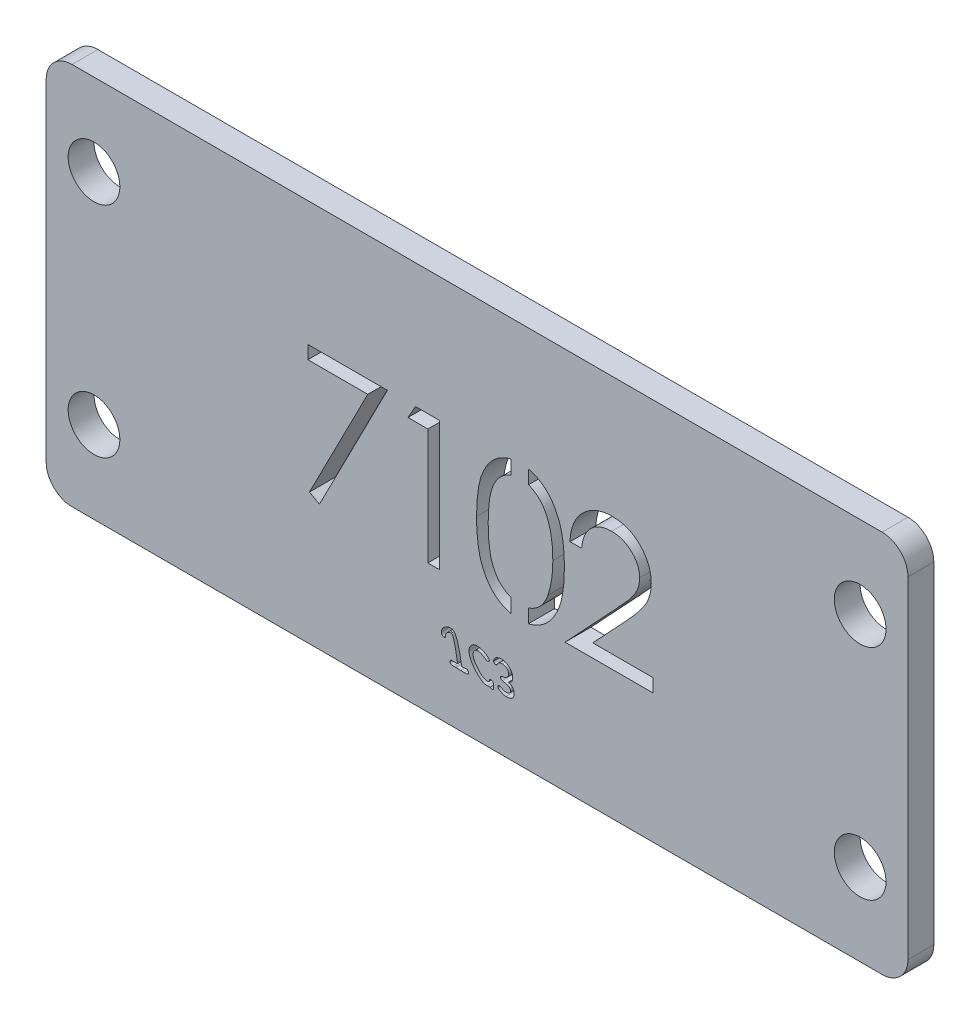
from build123d import *

# Parameters (mm, degrees)
SKETCH1_W               = 100
SKETCH1_H               = 44.45
SKETCH1_R               = 3
BOSS_EXTRUDE1_DEPTH     = 1.5
FILLET1_R               = 3
CUT_EXTRUDE1_DEPTH      = 55.799184529
CUT_EXTRUDE1_DEPTH_BACK = 55.799184529
BOSS_EXTRUDE2_DEPTH     = 3
CUT_EXTRUDE2_DEPTH      = 55.799184666
CUT_EXTRUDE2_DEPTH_BACK = 55.799184666


with BuildPart() as part:
    # Sketch1 → Boss-Extrude1 (new, symmetric)
    with BuildSketch(Plane.XY):
        Rectangle(SKETCH1_W, SKETCH1_H)
        with Locations((-44.45, 12.7)):
            Circle(SKETCH1_R, mode=Mode.SUBTRACT)
        with Locations((-44.45, -12.7)):
            Circle(SKETCH1_R, mode=Mode.SUBTRACT)
        with Locations((44.45, 12.7)):
            Circle(SKETCH1_R, mode=Mode.SUBTRACT)
        with Locations((44.45, -12.7)):
            Circle(SKETCH1_R, mode=Mode.SUBTRACT)
    extrude(amount=BOSS_EXTRUDE1_DEPTH, both=True)

    # Fillet1
    fillet1_edges = [part.edges().sort_by_distance(p)[0] for p in [
        (50, -22.225, 0),
        (-50, -22.225, 0),
        (-50, 22.225, 0),
        (50, 22.225, 0),
    ]]
    fillet(fillet1_edges, radius=FILLET1_R)

    # Sketch2 → Cut-Extrude1 (cut, two sides: drawn at the far end of the back side and taken through both)
    # profile 1 of 4: a face of its own
    with BuildSketch(Plane.XY.offset(1.5).offset(-CUT_EXTRUDE1_DEPTH_BACK)):
        Polygon((-19.634615385, 7.775), (-10.403846154, 7.775), (-18.288461538, -7.609615385), (-19.451322115, -6.969591346), (-12.681490385, 6.236538462), (-19.634615385, 6.236538462), align=None)
    # profile 2 of 4: a face of its own
    with BuildSketch(Plane.XY.offset(1.5).offset(-CUT_EXTRUDE1_DEPTH_BACK)):
        Polygon((-7.138822115, 7.775), (-4.365384615, 7.775), (-4.365384615, -7.225), (-5.711538462, -7.225), (-5.711538462, 6.236538462), (-8.019230769, 6.236538462), align=None)
    # profile 3 of 4: a face of its own
    with BuildSketch(Plane.XY.offset(1.5).offset(-CUT_EXTRUDE1_DEPTH_BACK)):
        with BuildLine():
            add(Edge.make_bspline(
                [(-0.057692308, 0.268990385), (-0.056286516, 0.509407761), (-0.053555744, 0.976421979), (-0.023176797, 1.656927588), (0.027288956, 2.295328826), (0.096449125, 2.891656252), (0.180611897, 3.446063814), (0.292963983, 3.957069916), (0.420733137, 4.427039659), (0.568815047, 4.857505581), (0.735905572, 5.254267165), (0.917766689, 5.624660885), (1.121615808, 5.96812631), (1.335802578, 6.290145411), (1.56899717, 6.58544696), (1.814563415, 6.858201228), (2.082085742, 7.102104445), (2.362470063, 7.324302883), (2.658254911, 7.519086333), (2.961009194, 7.690655213), (3.272816791, 7.837226073), (3.594529003, 7.952470798), (3.923254251, 8.047660141), (4.26014168, 8.112755631), (4.605747525, 8.153713811), (4.839025103, 8.157629529), (4.957331731, 8.159615385)],
                knots=[0, 0, 0, 0, 1.646270934, 3.197905019, 4.663502075, 6.030701355, 7.308322542, 8.50163776, 9.611534131, 10.641858119, 11.616356847, 12.558055219, 13.465016945, 14.349605745, 15.204443733, 16.039544428, 16.859896111, 17.680448484, 18.487036065, 19.28249412, 20.06191084, 20.843045899, 21.620316918, 22.403196591, 23.190181807, 24, 24, 24, 24], degree=3))
            add(Edge.make_bspline(
                [(4.957331731, 8.159615385), (5.076626639, 8.157524748), (5.313866677, 8.15336713), (5.664611142, 8.113407376), (6.007252635, 8.047102563), (6.340330372, 7.953155529), (6.666580314, 7.836602629), (6.983450633, 7.690514984), (7.292909554, 7.520462696), (7.590039358, 7.320646079), (7.878101995, 7.097864895), (8.150021836, 6.846024886), (8.405823633, 6.567668946), (8.648717799, 6.265775244), (8.871813216, 5.934553452), (9.084270782, 5.57976441), (9.27443665, 5.19520356), (9.457585258, 4.78728727), (9.615672344, 4.344728732), (9.758241967, 3.870022615), (9.873437547, 3.357561815), (9.969391571, 2.810035049), (10.043726839, 2.225431549), (10.097866734, 1.605004483), (10.12646567, 0.948345666), (10.131851532, 0.499383455), (10.134615385, 0.268990385)],
                knots=[0, 0, 0, 0, 0.810914788, 1.612654377, 2.396697861, 3.181598691, 3.963628158, 4.749916497, 5.551656086, 6.361998678, 7.18212741, 8.025565596, 8.878627764, 9.750805457, 10.657531673, 11.591944965, 12.560506719, 13.57287815, 14.630710178, 15.753379473, 16.941251878, 18.199788006, 19.531962791, 20.947069417, 22.433333509, 24, 24, 24, 24], degree=3))
            add(Edge.make_bspline(
                [(10.134615385, 0.268990385), (10.131822879, 0.039602208), (10.126381797, -0.4073513), (10.098187339, -1.06105548), (10.042650349, -1.678189951), (9.97317897, -2.260234791), (9.876960557, -2.804767443), (9.758652702, -3.313672222), (9.627294176, -3.789146815), (9.465145058, -4.227296007), (9.287670585, -4.634231962), (9.094576887, -5.014234027), (8.887706204, -5.370660995), (8.662325868, -5.700659911), (8.422096955, -6.006568441), (8.16187786, -6.282986824), (7.889003924, -6.536575418), (7.60009357, -6.76222525), (7.298329779, -6.959731556), (6.989933735, -7.136362343), (6.669433521, -7.278788179), (6.344092295, -7.401081212), (6.00925644, -7.49451172), (5.665343337, -7.559113958), (5.314102326, -7.60442188), (5.076667047, -7.607878222), (4.957331731, -7.609615385)],
                knots=[0, 0, 0, 0, 1.561518951, 3.042555995, 4.452378317, 5.7783523, 7.031515105, 8.214008947, 9.334062868, 10.386615937, 11.391082383, 12.354592575, 13.286541444, 14.194233754, 15.072674879, 15.931287219, 16.775624067, 17.606195743, 18.42308326, 19.229000347, 20.022332153, 20.807536673, 21.593273796, 22.3848459, 23.188221202, 24, 24, 24, 24], degree=3))
            add(Edge.make_bspline(
                [(4.957331731, -7.609615385), (4.839028385, -7.607616718), (4.605757279, -7.603675739), (4.260104027, -7.562902604), (3.924607841, -7.497350447), (3.597613181, -7.405565001), (3.277442402, -7.293215702), (2.968458316, -7.146842773), (2.667225386, -6.978268191), (2.374547289, -6.786287814), (2.095923742, -6.566337743), (1.829786862, -6.32306222), (1.582822494, -6.050390458), (1.352962084, -5.75262793), (1.134501706, -5.432514034), (0.933547249, -5.08567815), (0.74767216, -4.713495534), (0.577771486, -4.313561631), (0.427134357, -3.880040511), (0.29407275, -3.407972603), (0.189012076, -2.893191306), (0.099085124, -2.339831161), (0.026552054, -1.745514316), (-0.022966483, -1.109918124), (-0.053572119, -0.433438657), (-0.056293849, 0.030574661), (-0.057692308, 0.268990385)],
                knots=[0, 0, 0, 0, 0.810891512, 1.598919785, 2.382837074, 3.152667961, 3.926044502, 4.706494248, 5.493654104, 6.291793342, 7.103789334, 7.925228297, 8.761435821, 9.622817696, 10.50288917, 11.416980706, 12.369136599, 13.353924996, 14.394355917, 15.514179734, 16.714354668, 17.994756427, 19.357759367, 20.818452758, 22.365282078, 24, 24, 24, 24], degree=3))
        make_face()
        with BuildLine():
            add(Edge.make_bspline(
                [(1.288461538, 0.275), (1.288973454, 0.074648434), (1.289966983, -0.314194615), (1.315922128, -0.879237162), (1.351280265, -1.406252857), (1.396885825, -1.895910871), (1.464612747, -2.346553782), (1.540498981, -2.761280995), (1.632847936, -3.137897725), (1.742112298, -3.478988343), (1.866565571, -3.790341493), (2.002447844, -4.080060987), (2.14842237, -4.351569286), (2.311790158, -4.602427607), (2.489711858, -4.833454025), (2.678168683, -5.048737592), (2.884194044, -5.240724655), (3.169210083, -5.470982605), (3.545480688, -5.708921749), (4.019568353, -5.916119277), (4.506718857, -6.046329805), (4.837367072, -6.062888759), (5.002403846, -6.071153846)],
                knots=[0, 0, 0, 0, 1.459021318, 2.831673884, 4.118529203, 5.306027144, 6.411944654, 7.436330062, 8.375795394, 9.233974572, 10.042671642, 10.816086306, 11.563610507, 12.285937304, 12.993564865, 13.685989202, 14.367179055, 15.041617293, 16.353048772, 17.594441528, 18.799311195, 20, 20, 20, 20], degree=3))
            add(Edge.make_bspline(
                [(5.002403846, -6.071153846), (5.168508153, -6.064306214), (5.500373824, -6.050625088), (5.985232946, -5.918630499), (6.455934104, -5.71947533), (6.824813848, -5.483986021), (7.10545332, -5.259721752), (7.306526135, -5.068516116), (7.491077771, -4.854419542), (7.666115234, -4.62342256), (7.82665413, -4.371111913), (7.972639006, -4.098700876), (8.105853353, -3.805432971), (8.181749264, -3.600705518), (8.220552885, -3.496033654)],
                knots=[0, 0, 0, 0, 1.353760809, 2.704726607, 4.075137775, 5.516104923, 6.260822281, 7.007110065, 7.778089737, 8.566572457, 9.372053459, 10.217411131, 11.088608312, 12, 12, 12, 12], degree=3))
            add(Edge.make_bspline(
                [(8.220552885, -3.496033654), (8.265774747, -3.362191913), (8.35759452, -3.090435781), (8.475930696, -2.668877272), (8.569125264, -2.226579712), (8.65296826, -1.766186355), (8.710195642, -1.284301922), (8.756257699, -0.782417419), (8.783389214, -0.260154438), (8.786752433, 0.094681238), (8.788461538, 0.275)],
                knots=[0, 0, 0, 0, 0.884706709, 1.796334032, 2.740027952, 3.714592787, 4.726048262, 5.777819803, 6.87074269, 8, 8, 8, 8], degree=3))
            add(Edge.make_bspline(
                [(8.788461538, 0.275), (8.786103585, 0.455289597), (8.781490923, 0.807974588), (8.763859547, 1.324481077), (8.718329942, 1.815057195), (8.66776229, 2.281816364), (8.593202771, 2.722174804), (8.51281217, 3.139818969), (8.404806974, 3.52957479), (8.28943651, 3.897544426), (8.157391958, 4.239547231), (8.012038811, 4.557177744), (7.856802702, 4.851969421), (7.6881931, 5.123113457), (7.508211601, 5.371824355), (7.312107819, 5.593115474), (7.107660507, 5.793845338), (6.821301139, 6.022970634), (6.446411326, 6.256592186), (5.97992998, 6.4715883), (5.494484362, 6.595052411), (5.166312416, 6.612459641), (5.002403846, 6.621153846)],
                knots=[0, 0, 0, 0, 1.31362396, 2.569729283, 3.763502607, 4.902122613, 5.988968491, 7.01645872, 7.998833611, 8.933434873, 9.825090667, 10.667526885, 11.477055099, 12.250526234, 12.991942729, 13.710640831, 14.402115721, 15.076753259, 16.378508321, 17.609869233, 18.806226677, 20, 20, 20, 20], degree=3))
            add(Edge.make_bspline(
                [(5.002403846, 6.621153846), (4.836501309, 6.612447646), (4.504393999, 6.595019386), (4.013902764, 6.472048299), (3.543741257, 6.257707016), (3.169842794, 6.022196849), (2.883283709, 5.7978898), (2.681500738, 5.603376425), (2.492302857, 5.390606764), (2.318012713, 5.1574557), (2.154772928, 4.90688984), (2.004854303, 4.636937991), (1.869780033, 4.346232144), (1.745132021, 4.03501885), (1.635534358, 3.693957659), (1.545131658, 3.31780483), (1.461615716, 2.904396722), (1.402493135, 2.451313117), (1.349934182, 1.961532459), (1.316156976, 1.433201095), (1.289880159, 0.867210894), (1.288943883, 0.476357357), (1.288461538, 0.275)],
                knots=[0, 0, 0, 0, 1.207732386, 2.417664972, 3.655092373, 4.956220595, 5.625982001, 6.301752483, 6.994047911, 7.697131622, 8.419323945, 9.170223765, 9.943494443, 10.752040957, 11.610060368, 12.549350801, 13.567764191, 14.679664412, 15.874934091, 17.154273443, 18.533957287, 20, 20, 20, 20], degree=3))
        make_face(mode=Mode.SUBTRACT)
    # profile 4 of 4: a face of its own
    with BuildSketch(Plane.XY.offset(1.5).offset(-CUT_EXTRUDE1_DEPTH_BACK)):
        with BuildLine():
            Line((12.134615385, 3.159615385), (10.788461538, 3.159615385))
            add(Edge.make_bspline(
                [(10.788461538, 3.159615385), (10.797235051, 3.338204904), (10.814465997, 3.688949966), (10.895158665, 4.200338136), (11.010619568, 4.689144417), (11.173868656, 5.151444048), (11.376609847, 5.59132465), (11.619738536, 6.007039003), (11.907712181, 6.397001241), (12.234312469, 6.757596283), (12.589035208, 7.088400158), (12.971774949, 7.374065485), (13.373967923, 7.615426933), (13.794393918, 7.817203684), (14.237796334, 7.968660166), (14.700151439, 8.081038622), (15.183490595, 8.148651532), (15.512804975, 8.155919185), (15.680288462, 8.159615385)],
                knots=[0, 0, 0, 0, 1.10065271, 2.161652631, 3.183658789, 4.190468796, 5.17591951, 6.163126047, 7.15150782, 8.156236427, 9.156009102, 10.134482811, 11.092018607, 12.041330605, 13.001268258, 13.972401359, 14.968799086, 16, 16, 16, 16], degree=3))
            add(Edge.make_bspline(
                [(15.680288462, 8.159615385), (15.844765922, 8.155764857), (16.167958256, 8.148198708), (16.639652604, 8.083222868), (17.088698152, 7.981456047), (17.514217151, 7.838675691), (17.91281457, 7.646742431), (18.287484761, 7.416181551), (18.642688236, 7.149525131), (18.962431595, 6.835580216), (19.256037648, 6.50042714), (19.509333028, 6.142621838), (19.726246585, 5.773067757), (19.907050928, 5.388946893), (20.040148666, 4.986642485), (20.141198129, 4.572011616), (20.198315616, 4.140762426), (20.207081717, 3.848877188), (20.211538462, 3.700480769)],
                knots=[0, 0, 0, 0, 1.111607364, 2.184268762, 3.212621178, 4.221274766, 5.211760367, 6.196651075, 7.1921475, 8.207485113, 9.220403448, 10.201281604, 11.166441695, 12.114753415, 13.065576456, 14.026450734, 14.996634279, 16, 16, 16, 16], degree=3))
            add(Edge.make_bspline(
                [(20.211538462, 3.700480769), (20.204281621, 3.491561478), (20.189895286, 3.077389134), (20.066833673, 2.468754008), (19.874634339, 1.879067926), (19.643217096, 1.404479489), (19.409763764, 1.02205023), (19.199388731, 0.707184351), (18.95311097, 0.368160915), (18.667345979, 0.006115184), (18.348005098, -0.381788695), (17.992195826, -0.79531639), (17.597380903, -1.230195403), (17.320273043, -1.527219409), (17.176682692, -1.681129808)],
                knots=[0, 0, 0, 0, 1.184426356, 2.348067706, 3.509069118, 4.696110526, 5.333549288, 6.050745305, 6.844228056, 7.710549037, 8.667450064, 9.695053472, 10.805634456, 12, 12, 12, 12], degree=3))
            Line((17.176682692, -1.681129808), (13.423677885, -5.686538462))
            Line((13.423677885, -5.686538462), (20.403846154, -5.686538462))
            Line((20.403846154, -5.686538462), (20.403846154, -7.225))
            Line((20.403846154, -7.225), (10.211538462, -7.225))
            Line((10.211538462, -7.225), (16.028846154, -1.017067308))
            add(Edge.make_bspline(
                [(16.028846154, -1.017067308), (16.170479954, -0.869217422), (16.442529499, -0.585228051), (16.827311971, -0.170615365), (17.172907635, 0.214025524), (17.481553605, 0.567967874), (17.746554342, 0.896388879), (17.98172105, 1.188651895), (18.170145011, 1.457599539), (18.374639564, 1.769345027), (18.572699485, 2.149969243), (18.742895296, 2.615113626), (18.846673218, 3.093944709), (18.859122513, 3.417524868), (18.865384615, 3.580288462)],
                knots=[0, 0, 0, 0, 1.329631726, 2.553950428, 3.673215718, 4.687767853, 5.603093632, 6.413772471, 7.123043292, 7.734684054, 8.834405432, 9.900288307, 10.943827018, 12, 12, 12, 12], degree=3))
            add(Edge.make_bspline(
                [(18.865384615, 3.580288462), (18.862660006, 3.682637312), (18.857290323, 3.884347242), (18.809900191, 4.180086209), (18.738283736, 4.465363983), (18.635661201, 4.741058065), (18.500203744, 5.004396573), (18.33531783, 5.25570006), (18.145074701, 5.498652768), (17.924997832, 5.726452617), (17.683234176, 5.935086355), (17.427830249, 6.119903864), (17.157615517, 6.274357196), (16.873729279, 6.400972184), (16.576962981, 6.500295246), (16.266742645, 6.569117729), (15.943925433, 6.612328375), (15.723496165, 6.618174826), (15.611177885, 6.621153846)],
                knots=[0, 0, 0, 0, 0.991446411, 1.95395049, 2.89581595, 3.838931463, 4.798493298, 5.75982156, 6.748411868, 7.785213223, 8.824556874, 9.840280684, 10.836137867, 11.835679398, 12.848801643, 13.863922112, 14.911575587, 16, 16, 16, 16], degree=3))
            add(Edge.make_bspline(
                [(15.611177885, 6.621153846), (15.493874316, 6.618089422), (15.263509475, 6.612071399), (14.925285048, 6.569974268), (14.602631716, 6.497349238), (14.294737846, 6.398020633), (14.001082478, 6.27176971), (13.723093718, 6.114519375), (13.461395621, 5.926875833), (13.215496235, 5.714130592), (12.988936325, 5.477269444), (12.789878286, 5.213226745), (12.615946796, 4.926823536), (12.464192939, 4.618832605), (12.340954267, 4.286459262), (12.246783622, 3.930883385), (12.172268565, 3.553648893), (12.147374905, 3.293141386), (12.134615385, 3.159615385)],
                knots=[0, 0, 0, 0, 1.031018746, 2.02475058, 2.990194455, 3.934040569, 4.864654155, 5.795059489, 6.735614925, 7.690564532, 8.649604399, 9.611025574, 10.590972636, 11.591080095, 12.624614302, 13.701020113, 14.821632451, 16, 16, 16, 16], degree=3))
        make_face()
    extrude(amount=CUT_EXTRUDE1_DEPTH + CUT_EXTRUDE1_DEPTH_BACK, mode=Mode.SUBTRACT)


with BuildPart() as cut_extrude1_piece_1:
    # of the separate pieces the step leaves, piece 1, a body of its own (cut_extrude1_pieces)
    add(part.part.solids().sort_by_distance((-47, 22.225, -1.5))[0])



with BuildPart() as cut_extrude1_piece_2:
    # of the separate pieces the step leaves, piece 2, a body of its own (cut_extrude1_pieces)
    add(part.part.solids().sort_by_distance((5.002403846, -6.071153846, -1.5))[0])


with BuildPart() as cut_extrude1_piece_1_1:
    add(cut_extrude1_piece_1.part)

    add(cut_extrude1_piece_2.part)  # Boss-Extrude2 merges Cut-Extrude1 piece 2
    # Sketch3 → Boss-Extrude2 (add)
    with BuildSketch(Plane.XY.offset(1.5)):
        with BuildLine():
            Line((3.957331731, 8.050377123), (3.957331731, -7.500292543))
            add(Edge.make_bspline(
                [(3.957331731, -7.500292543), (4.05753866, -7.523279041), (4.271562404, -7.56425423), (4.605757279, -7.603675739), (4.839028385, -7.607616718), (4.957331731, -7.609615385)],
                knots=[0.904006407, 0.904006407, 0.904006407, 0.904006407, 0.933378342, 0.966212854, 1, 1, 1, 1], degree=3))
            add(Edge.make_bspline(
                [(4.957331731, -7.609615385), (5.076667047, -7.607878222), (5.314102326, -7.60442188), (5.647797296, -7.561377289), (5.860999806, -7.522283099), (5.957331731, -7.501121607)],
                knots=[0, 0, 0, 0, 0.033824117, 0.067298088, 0.095270816, 0.095270816, 0.095270816, 0.095270816], degree=3))
            Line((5.957331731, -7.501121607), (5.957331731, 8.053670705))
            add(Edge.make_bspline(
                [(5.957331731, 8.053670705), (5.861064795, 8.075297329), (5.648041313, 8.11529515), (5.313866677, 8.15336713), (5.076626639, 8.157524748), (4.957331731, 8.159615385)],
                knots=[0.904855277, 0.904855277, 0.904855277, 0.904855277, 0.932806068, 0.966211884, 1, 1, 1, 1], degree=3))
            add(Edge.make_bspline(
                [(4.957331731, 8.159615385), (4.839025103, 8.157629529), (4.605747525, 8.153713811), (4.271605446, 8.114114216), (4.057482769, 8.073553546), (3.957331731, 8.050377123)],
                knots=[0, 0, 0, 0, 0.033742425, 0.066533475, 0.095864536, 0.095864536, 0.095864536, 0.095864536], degree=3))
        make_face()
    extrude(amount=-BOSS_EXTRUDE2_DEPTH)

    # Sketch4 → Cut-Extrude2 (cut, two sides: drawn at the far end of the back side and taken through both)
    with BuildSketch(Plane.XY.offset(1.5).offset(-CUT_EXTRUDE2_DEPTH_BACK)):
        with BuildLine():
            Line((-1.803030303, -15.659563791), (-1.83478093, -15.391372322))
            add(Edge.make_bspline(
                [(-1.83478093, -15.391372322), (-1.838791817, -15.361417865), (-1.84733335, -15.297627235), (-1.861790666, -15.196598295), (-1.881459572, -15.084870649), (-1.902612259, -14.962248101), (-1.92790069, -14.828759938), (-1.956426378, -14.684492134), (-1.987156798, -14.528951999), (-2.021845987, -14.365733916), (-2.058360774, -14.20068053), (-2.095087787, -14.039450697), (-2.134101401, -13.885648322), (-2.171987478, -13.738304551), (-2.211976274, -13.598527735), (-2.252760781, -13.466025146), (-2.292913425, -13.340077369), (-2.334598138, -13.221579954), (-2.377198661, -13.111397603), (-2.418396834, -13.009739992), (-2.46140469, -12.918300157), (-2.503568291, -12.835801878), (-2.546088044, -12.762671368), (-2.588245162, -12.69887736), (-2.631135936, -12.64500747), (-2.673961716, -12.5996053), (-2.718185162, -12.56207822), (-2.762609309, -12.529296553), (-2.808937663, -12.502208132), (-2.856398688, -12.479810737), (-2.905144033, -12.461920905), (-2.955297518, -12.450069108), (-3.006605383, -12.442194157), (-3.041275043, -12.441130431), (-3.058868944, -12.44059062)],
                knots=[0, 0, 0, 0, 0.861025079, 1.83362803, 2.907299908, 4.09281043, 5.378739262, 6.777822971, 8.282583123, 9.895641268, 11.531577219, 13.098678827, 14.606403677, 16.051973885, 17.432847484, 18.747860734, 20.001670704, 21.198789253, 22.325872299, 23.367142969, 24.32288474, 25.203757155, 26.005885643, 26.731845435, 27.380085169, 27.965434192, 28.50680305, 29.030355132, 29.536479874, 30.032957788, 30.524059654, 31.012640878, 31.498942354, 32, 32, 32, 32], degree=3))
            add(Edge.make_bspline(
                [(-3.058868944, -12.44059062), (-3.090888286, -12.441306138), (-3.154513758, -12.442727942), (-3.249279449, -12.456168102), (-3.342336055, -12.477830276), (-3.434573423, -12.507577631), (-3.524518599, -12.547246915), (-3.614024895, -12.593765604), (-3.700877595, -12.650474142), (-3.785563521, -12.713537234), (-3.864489909, -12.782102662), (-3.934332395, -12.854277329), (-3.993608767, -12.92882371), (-4.042253663, -13.005657409), (-4.079759844, -13.085089241), (-4.10604951, -13.166867592), (-4.123249652, -13.250754192), (-4.125231801, -13.307681992), (-4.126230457, -13.336363636)],
                knots=[0, 0, 0, 0, 1.006642368, 2.000293963, 3.00364191, 4.009312049, 5.043484871, 6.092156714, 7.178608564, 8.301927419, 9.411293414, 10.463213109, 11.456536496, 12.4017534, 13.317424947, 14.211110405, 15.098712852, 16, 16, 16, 16], degree=3))
            add(Edge.make_bspline(
                [(-4.126230457, -13.336363636), (-4.125298961, -13.367704305), (-4.123547696, -13.426626483), (-4.111440576, -13.509085946), (-4.089491887, -13.579182593), (-4.058236012, -13.637044072), (-4.017435607, -13.682591555), (-3.967238918, -13.715319584), (-3.907822498, -13.734801736), (-3.865396774, -13.736662813), (-3.843176993, -13.737637522)],
                knots=[0, 0, 0, 0, 1.348882712, 2.535973565, 3.574998766, 4.494709461, 5.345502407, 6.178837615, 7.046195888, 8, 8, 8, 8], degree=3))
            add(Edge.make_bspline(
                [(-3.843176993, -13.737637522), (-3.827597245, -13.736961264), (-3.798411808, -13.735694435), (-3.757263244, -13.727103371), (-3.722257907, -13.711692033), (-3.693496576, -13.689372569), (-3.671385054, -13.660758781), (-3.655618456, -13.626140239), (-3.647268361, -13.585349744), (-3.645944269, -13.556402036), (-3.645242231, -13.541053851)],
                knots=[0, 0, 0, 0, 1.169592044, 2.190988839, 3.136834393, 4.016123501, 4.895412608, 5.82587258, 6.847269375, 8, 8, 8, 8], degree=3))
            Line((-3.645242231, -13.541053851), (-3.65402432, -13.423508975))
            add(Edge.make_bspline(
                [(-3.65402432, -13.423508975), (-3.653430458, -13.408353599), (-3.652236322, -13.377879216), (-3.640625442, -13.332869075), (-3.622933716, -13.288590442), (-3.598106582, -13.244796028), (-3.566099742, -13.201743838), (-3.527286404, -13.158879305), (-3.481048586, -13.117213298), (-3.411918794, -13.063539251), (-3.321377322, -13.004467577), (-3.209136571, -12.951479216), (-3.096583072, -12.918047462), (-3.021025623, -12.914074315), (-2.98388342, -12.912121212)],
                knots=[0, 0, 0, 0, 0.597861281, 1.202177569, 1.825140209, 2.478563473, 3.185144865, 3.941155822, 4.760016611, 5.641153635, 7.398590742, 9.018861587, 10.534544956, 12, 12, 12, 12], degree=3))
            add(Edge.make_bspline(
                [(-2.98388342, -12.912121212), (-2.975374853, -12.912881751), (-2.957318952, -12.91449568), (-2.932017149, -12.929986889), (-2.906413714, -12.952225212), (-2.881404841, -12.983951255), (-2.854882777, -13.023255798), (-2.828613987, -13.071735161), (-2.802859364, -13.129170744), (-2.77574372, -13.194928156), (-2.74803042, -13.269206048), (-2.720675715, -13.352523643), (-2.692108717, -13.444295562), (-2.664107156, -13.545143856), (-2.634821421, -13.654475083), (-2.606133545, -13.772855313), (-2.576172863, -13.899759206), (-2.547240521, -14.03320246), (-2.519044674, -14.1677684), (-2.490841976, -14.29844653), (-2.465659727, -14.423120611), (-2.440951839, -14.54144122), (-2.418825654, -14.653662444), (-2.398108923, -14.759539994), (-2.377742255, -14.859065036), (-2.361772599, -14.952813409), (-2.344864667, -15.040199859), (-2.330877416, -15.121533361), (-2.318744866, -15.196787082), (-2.30794067, -15.265694335), (-2.298361154, -15.328246117), (-2.290725893, -15.384755513), (-2.285478598, -15.435024621), (-2.282635403, -15.466580158), (-2.281316348, -15.481219842)],
                knots=[0, 0, 0, 0, 0.299179231, 0.634883757, 1.025333039, 1.501564715, 2.059425154, 2.705988964, 3.452434313, 4.289900373, 5.226887547, 6.26173691, 7.397827598, 8.633439254, 9.971242789, 11.409581512, 12.950682971, 14.592986099, 16.249214419, 17.824050954, 19.331486482, 20.757525879, 22.108408744, 23.38572391, 24.581642047, 25.708894495, 26.756196704, 27.736414872, 28.633952566, 29.458037324, 30.208695464, 30.876965962, 31.478986416, 32, 32, 32, 32], degree=3))
            add(Edge.make_bspline(
                [(-2.281316348, -15.481219842), (-2.27940089, -15.503299136), (-2.27509529, -15.552929347), (-2.26910446, -15.602385504), (-2.265778807, -15.629839799)],
                knots=[0, 0, 0, 0, 0.889752191, 2, 2, 2, 2], degree=3))
            Line((-2.265778807, -15.629839799), (-2.518432735, -15.629839799))
            add(Edge.make_bspline(
                [(-2.518432735, -15.629839799), (-2.54230576, -15.630165225), (-2.593448472, -15.630862378), (-2.644539423, -15.633279688), (-2.671781509, -15.634568616)],
                knots=[0, 0, 0, 0, 0.933584651, 2, 2, 2, 2], degree=3))
            Line((-2.671781509, -15.634568616), (-2.82850801, -15.639297433))
            add(Edge.make_bspline(
                [(-2.82850801, -15.639297433), (-2.848781305, -15.639736296), (-2.885724246, -15.640536012), (-2.938151586, -15.63864655), (-2.987834068, -15.640826818), (-3.036407265, -15.656132031), (-3.083665234, -15.682216586), (-3.119175493, -15.725072635), (-3.144488362, -15.776888566), (-3.146842782, -15.815537545), (-3.148040919, -15.835205559)],
                knots=[0, 0, 0, 0, 1.125932141, 2.051725948, 2.917150571, 3.870919263, 4.857829588, 5.868709325, 6.915411049, 8, 8, 8, 8], degree=3))
            add(Edge.make_bspline(
                [(-3.148040919, -15.835205559), (-3.147232293, -15.856963277), (-3.145704074, -15.898083141), (-3.128024809, -15.955650709), (-3.099577748, -16.004800466), (-3.058416837, -16.044523709), (-3.006520469, -16.075492383), (-2.942876657, -16.095223626), (-2.869215991, -16.109425133), (-2.816206617, -16.110340517), (-2.787975294, -16.110828025)],
                knots=[0, 0, 0, 0, 1.00687659, 1.902893857, 2.765110339, 3.615076267, 4.529258913, 5.543971237, 6.691987181, 8, 8, 8, 8], degree=3))
            add(Edge.make_bspline(
                [(-2.787975294, -16.110828025), (-2.772887726, -16.110629219), (-2.74023171, -16.110198916), (-2.687075062, -16.108894868), (-2.62604278, -16.1061485), (-2.582605653, -16.103464784), (-2.559640996, -16.102045937)],
                knots=[0, 0, 0, 0, 0.792290862, 1.714859736, 2.791875405, 4, 4, 4, 4], degree=3))
            Line((-2.559640996, -16.102045937), (-2.429936306, -16.09731712))
            add(Edge.make_bspline(
                [(-2.429936306, -16.09731712), (-2.393005825, -16.096588493), (-2.314409323, -16.095037809), (-2.189173351, -16.098592114), (-2.04970189, -16.104097768), (-1.95208132, -16.111619688), (-1.900984366, -16.115556842)],
                knots=[0, 0, 0, 0, 0.836995302, 1.781317286, 2.838688115, 4, 4, 4, 4], degree=3))
            add(Edge.make_bspline(
                [(-1.900984366, -16.115556842), (-1.855059786, -16.118921449), (-1.769779624, -16.125169392), (-1.651277528, -16.130794402), (-1.551988623, -16.135506283), (-1.492058346, -16.136192065), (-1.465257672, -16.136498745)],
                knots=[0, 0, 0, 0, 1.266422424, 2.351697286, 3.262883029, 4, 4, 4, 4], degree=3))
            add(Edge.make_bspline(
                [(-1.465257672, -16.136498745), (-1.427398919, -16.135999258), (-1.356680677, -16.135066241), (-1.258010901, -16.124571671), (-1.174460724, -16.106923163), (-1.105373644, -16.082535666), (-1.050649725, -16.050162271), (-1.011155886, -16.009251821), (-0.985869273, -15.960204511), (-0.983471053, -15.924449597), (-0.98224281, -15.906137811)],
                knots=[0, 0, 0, 0, 1.532976001, 2.863521814, 4.012093281, 4.984605238, 5.819944757, 6.561877237, 7.263469193, 8, 8, 8, 8], degree=3))
            add(Edge.make_bspline(
                [(-0.98224281, -15.906137811), (-0.983025137, -15.889556806), (-0.984603633, -15.85610141), (-1.001809224, -15.807709613), (-1.025935523, -15.760037413), (-1.061070637, -15.716744773), (-1.101687423, -15.678508714), (-1.1478324, -15.649767375), (-1.198403264, -15.632878156), (-1.233423286, -15.630859369), (-1.251109824, -15.629839799)],
                knots=[0, 0, 0, 0, 0.934439524, 1.885412987, 2.877088495, 3.947727721, 5.020866232, 6.021749393, 7.000902827, 8, 8, 8, 8], degree=3))
            Line((-1.251109824, -15.629839799), (-1.540918742, -15.664292608))
            Line((-1.540918742, -15.664292608), (-1.659139162, -15.664292608))
            add(Edge.make_bspline(
                [(-1.659139162, -15.664292608), (-1.682112214, -15.663981873), (-1.730105893, -15.663332708), (-1.778040482, -15.660855328), (-1.803030303, -15.659563791)],
                knots=[0, 0, 0, 0, 0.957336567, 2, 2, 2, 2], degree=3))
        make_face()
        with BuildLine():
            add(Edge.make_bspline(
                [(1.533487744, -16.074348581), (1.549696783, -16.092207633), (1.580557946, -16.126210332), (1.636075274, -16.163798111), (1.695477124, -16.186734552), (1.736636561, -16.189729428), (1.757093225, -16.191217912)],
                knots=[0, 0, 0, 0, 1.107269843, 2.108183785, 3.059747876, 4, 4, 4, 4], degree=3))
            add(Edge.make_bspline(
                [(1.757093225, -16.191217912), (1.770462393, -16.190484424), (1.796236542, -16.189070348), (1.832598984, -16.176921423), (1.862647128, -16.154641598), (1.88737363, -16.125086222), (1.905593932, -16.086918463), (1.918887127, -16.041112207), (1.926659141, -15.987011185), (1.927539767, -15.94827254), (1.928006176, -15.92775526)],
                knots=[0, 0, 0, 0, 0.902482325, 1.739877503, 2.546565659, 3.399985717, 4.318744041, 5.382795274, 6.613840947, 8, 8, 8, 8], degree=3))
            add(Edge.make_bspline(
                [(1.928006176, -15.92775526), (1.927794828, -15.897574188), (1.927390846, -15.83988468), (1.923052481, -15.757220808), (1.9174302, -15.68234677), (1.908697691, -15.615133233), (1.897537629, -15.555704172), (1.883470166, -15.50389638), (1.866889097, -15.459883214), (1.842246043, -15.412749269), (1.804795081, -15.365678252), (1.751354975, -15.323612906), (1.689075996, -15.298507294), (1.645176281, -15.295590073), (1.622659718, -15.294093804)],
                knots=[0, 0, 0, 0, 1.381224257, 2.640136457, 3.787911809, 4.817014253, 5.740754603, 6.553400719, 7.271165096, 7.888953339, 8.981879346, 9.996113944, 10.972188614, 12, 12, 12, 12], degree=3))
            add(Edge.make_bspline(
                [(1.622659718, -15.294093804), (1.611133025, -15.294631626), (1.588730041, -15.295676923), (1.556732777, -15.303205294), (1.527507957, -15.315482788), (1.501673739, -15.333303214), (1.478883863, -15.356258704), (1.459363914, -15.384158662), (1.443111243, -15.417073726), (1.435023722, -15.441027166), (1.430804864, -15.453522486)],
                knots=[0, 0, 0, 0, 1.022512575, 1.987329153, 2.900668239, 3.820979481, 4.753794939, 5.757576786, 6.830239144, 8, 8, 8, 8], degree=3))
            add(Edge.make_bspline(
                [(1.430804864, -15.453522486), (1.423255799, -15.477600599), (1.409734294, -15.5207281), (1.384724669, -15.575174512), (1.3591052, -15.613164977), (1.327443128, -15.63490549), (1.288422057, -15.638939438), (1.240784594, -15.645383937), (1.179249865, -15.646910525), (1.133999974, -15.647666147), (1.109245319, -15.648079521)],
                knots=[0, 0, 0, 0, 1.40427435, 2.515265406, 3.330636154, 3.929086192, 4.581020839, 5.477292456, 6.619913754, 8, 8, 8, 8], degree=3))
            add(Edge.make_bspline(
                [(1.109245319, -15.648079521), (1.092329615, -15.647522012), (1.057639862, -15.646378703), (1.005118487, -15.638009156), (0.951328531, -15.623966914), (0.895707342, -15.606055066), (0.839011171, -15.581313655), (0.781025623, -15.551381702), (0.72103927, -15.516802962), (0.660147737, -15.476325542), (0.59761797, -15.430634888), (0.5335123, -15.380061383), (0.468015513, -15.323859402), (0.401143437, -15.262301939), (0.332942007, -15.195330844), (0.263349911, -15.123002981), (0.192468983, -15.04502455), (0.096954526, -14.936480201), (-0.015490511, -14.799540707), (-0.134487001, -14.634954714), (-0.236908956, -14.476455354), (-0.319880339, -14.321944972), (-0.384712561, -14.172423091), (-0.431525064, -14.027827532), (-0.459940363, -13.887594507), (-0.464099347, -13.795402649), (-0.46612623, -13.750472882)],
                knots=[0, 0, 0, 0, 0.466927782, 0.957548594, 1.46417568, 2.000882638, 2.569037736, 3.169601369, 3.80192136, 4.479560001, 5.187109532, 5.939581763, 6.733249674, 7.569227768, 8.448469669, 9.371794959, 10.339911268, 11.357523543, 13.363521112, 15.22884061, 16.962053979, 18.569664471, 20.065154068, 21.455190761, 22.75978542, 24, 24, 24, 24], degree=3))
            add(Edge.make_bspline(
                [(-0.46612623, -13.750472882), (-0.465876605, -13.731750015), (-0.465381293, -13.694599752), (-0.457145612, -13.639809933), (-0.44638244, -13.586184641), (-0.428785398, -13.53472263), (-0.408158356, -13.484545774), (-0.382228799, -13.436045936), (-0.350800009, -13.389742322), (-0.316165116, -13.344555944), (-0.277581117, -13.303015998), (-0.235224904, -13.266704292), (-0.189773283, -13.236302283), (-0.141379545, -13.210931748), (-0.089838615, -13.191481195), (-0.035562234, -13.177095093), (0.021820698, -13.168969779), (0.060999075, -13.167982821), (0.081065431, -13.167477321)],
                knots=[0, 0, 0, 0, 1.007215336, 1.99853557, 2.978515825, 3.948768053, 4.921744863, 5.898342626, 6.90402363, 7.932550791, 8.962149819, 9.95131654, 10.93009547, 11.90102956, 12.887516414, 13.890561675, 14.91958918, 16, 16, 16, 16], degree=3))
            add(Edge.make_bspline(
                [(0.081065431, -13.167477321), (0.114438843, -13.168388114), (0.180813418, -13.170199542), (0.27979144, -13.184798064), (0.377009771, -13.209603853), (0.458083743, -13.236947517), (0.524543313, -13.26630259), (0.580513638, -13.292225367), (0.641202863, -13.324490859), (0.70771409, -13.361062998), (0.779738668, -13.402675296), (0.856627529, -13.450338687), (0.939103555, -13.50227063), (0.995574389, -13.538955426), (1.024802162, -13.557942482)],
                knots=[0, 0, 0, 0, 1.157869409, 2.302823844, 3.462774734, 4.636672592, 5.266714328, 5.98337016, 6.77682262, 7.651231995, 8.617636589, 9.663056161, 10.790461231, 12, 12, 12, 12], degree=3))
            add(Edge.make_bspline(
                [(1.024802162, -13.557942482), (1.047578321, -13.57182833), (1.088860281, -13.596996534), (1.14688174, -13.625851322), (1.193796655, -13.645979836), (1.222616704, -13.649617671), (1.234896738, -13.651167728)],
                knots=[0, 0, 0, 0, 1.380160298, 2.501550965, 3.361520657, 4, 4, 4, 4], degree=3))
            add(Edge.make_bspline(
                [(1.234896738, -13.651167728), (1.24872978, -13.6506809), (1.275789905, -13.649728569), (1.314051754, -13.637505465), (1.348818388, -13.619172363), (1.378363092, -13.593165109), (1.402708692, -13.562234501), (1.420491552, -13.527120619), (1.43183832, -13.488831324), (1.432944679, -13.462094548), (1.433507045, -13.44850415)],
                knots=[0, 0, 0, 0, 1.044454695, 2.043156897, 3.012862137, 4.00498183, 5.001786883, 5.978673006, 6.972552298, 8, 8, 8, 8], degree=3))
            add(Edge.make_bspline(
                [(1.433507045, -13.44850415), (1.433022864, -13.437410286), (1.432029887, -13.414658563), (1.422305305, -13.380429387), (1.408180679, -13.34550317), (1.391787624, -13.315279801), (1.372079354, -13.289203651), (1.349040325, -13.266535358), (1.319620151, -13.23954307), (1.282320127, -13.210458386), (1.238087463, -13.17694927), (1.186587108, -13.140431709), (1.127982664, -13.100081268), (1.040882992, -13.043400365), (0.92837333, -12.974476774), (0.792532662, -12.899963343), (0.657994584, -12.838632998), (0.52557527, -12.788189408), (0.394987008, -12.74846032), (0.265683319, -12.721064786), (0.137873761, -12.702965407), (0.0529772, -12.700984116), (0.010808724, -12.7)],
                knots=[0, 0, 0, 0, 0.393722528, 0.807461306, 1.256581172, 1.733407316, 2.024921627, 2.415701006, 2.880608868, 3.44468348, 4.096578489, 4.854388757, 5.689619564, 6.626992097, 8.549869502, 10.381036854, 12.133456371, 13.803783599, 15.417712787, 16.982183739, 18.501038064, 20, 20, 20, 20], degree=3))
            add(Edge.make_bspline(
                [(0.010808724, -12.7), (-0.023468176, -12.700903421), (-0.090494925, -12.702670014), (-0.188433036, -12.716647331), (-0.2814587, -12.73847121), (-0.369211242, -12.770688354), (-0.452124573, -12.811388305), (-0.530429262, -12.86101822), (-0.60356701, -12.920011725), (-0.67049626, -12.987690341), (-0.731721076, -13.060412457), (-0.784470712, -13.138164), (-0.830147521, -13.218303874), (-0.866701959, -13.302471415), (-0.896044802, -13.389367468), (-0.916012209, -13.479757103), (-0.928712533, -13.573117004), (-0.930163251, -13.636488682), (-0.93090137, -13.668731905)],
                knots=[0, 0, 0, 0, 1.090431706, 2.132284199, 3.142147496, 4.12604648, 5.100346733, 6.076490108, 7.070334407, 8.083801922, 9.101365703, 10.091249055, 11.069914497, 12.032575276, 13.007033647, 13.98409728, 14.974317799, 16, 16, 16, 16], degree=3))
            add(Edge.make_bspline(
                [(-0.93090137, -13.668731905), (-0.930440247, -13.699154622), (-0.929512673, -13.760351604), (-0.920030297, -13.852565611), (-0.906162721, -13.945790854), (-0.885668238, -14.040063533), (-0.859013394, -14.135295911), (-0.827528607, -14.231974319), (-0.789258585, -14.329360346), (-0.745891454, -14.428010345), (-0.69759645, -14.528293896), (-0.64158175, -14.62871441), (-0.58100612, -14.7306994), (-0.514530406, -14.833674118), (-0.442286337, -14.93743381), (-0.364370401, -15.04244279), (-0.280485655, -15.148483382), (-0.191935966, -15.254344226), (-0.100784804, -15.357376055), (-0.010107772, -15.455460802), (0.080917391, -15.546034565), (0.170209594, -15.630482978), (0.259216579, -15.707751622), (0.346860934, -15.778805684), (0.433797621, -15.843288182), (0.520641232, -15.899802521), (0.605718391, -15.950903713), (0.690107728, -15.995152297), (0.774341257, -16.031483618), (0.85740257, -16.062268934), (0.939842275, -16.08592435), (1.021327107, -16.102959268), (1.10198357, -16.113564178), (1.155601826, -16.114896045), (1.182204208, -16.115556842)],
                knots=[0, 0, 0, 0, 0.845053938, 1.699872818, 2.573267038, 3.463003571, 4.378353787, 5.320180263, 6.286908739, 7.284332091, 8.314121874, 9.378257032, 10.478139744, 11.609724538, 12.78304169, 13.990642087, 15.24241566, 16.53942405, 17.824941787, 19.064537138, 20.250251021, 21.392270467, 22.478831627, 23.524410259, 24.526805978, 25.484747311, 26.402212168, 27.2837488, 28.129983257, 28.949471659, 29.743606772, 30.510557297, 31.261021768, 32, 32, 32, 32], degree=3))
            add(Edge.make_bspline(
                [(1.182204208, -16.115556842), (1.220959903, -16.115092278), (1.292247961, -16.114237749), (1.389674577, -16.106994169), (1.469007003, -16.096096889), (1.513810938, -16.080985249), (1.533487744, -16.074348581)],
                knots=[0, 0, 0, 0, 1.308187557, 2.406308259, 3.300089093, 4, 4, 4, 4], degree=3))
        make_face()
        with BuildLine():
            add(Edge.make_bspline(
                [(3.65537541, -14.526674387), (3.693014542, -14.511470669), (3.765542022, -14.482174367), (3.863328542, -14.423125324), (3.947398517, -14.354932643), (4.014682116, -14.274643886), (4.068146414, -14.185235467), (4.105020019, -14.085156122), (4.127756532, -13.97532391), (4.130314451, -13.89875807), (4.13163482, -13.859235669)],
                knots=[0, 0, 0, 0, 1.103312873, 2.12599221, 3.09666515, 4.03597176, 4.961968194, 5.918138116, 6.925366979, 8, 8, 8, 8], degree=3))
            add(Edge.make_bspline(
                [(4.13163482, -13.859235669), (4.130442428, -13.817066631), (4.128091708, -13.733933235), (4.110172631, -13.611631161), (4.080445794, -13.494084206), (4.038381917, -13.381214884), (3.98360289, -13.273357949), (3.918229999, -13.169437197), (3.83945539, -13.071285334), (3.751224395, -12.97827131), (3.654851281, -12.893032897), (3.552679861, -12.818647329), (3.446472741, -12.755170201), (3.336443248, -12.702962403), (3.221850981, -12.66266847), (3.103151436, -12.634764403), (2.980416678, -12.616157749), (2.897032394, -12.614412834), (2.854854275, -12.613530207)],
                knots=[0, 0, 0, 0, 1.022528466, 2.015845511, 2.990809012, 3.958632639, 4.930777169, 5.920212585, 6.931004324, 7.977965367, 9.026634573, 10.046987304, 11.038936981, 12.023536713, 12.996049399, 13.978996544, 14.977719538, 16, 16, 16, 16], degree=3))
            add(Edge.make_bspline(
                [(2.854854275, -12.613530207), (2.823540697, -12.614087081), (2.762399759, -12.615174399), (2.672788562, -12.62255038), (2.587267214, -12.635446767), (2.505839325, -12.653225765), (2.428836886, -12.677447418), (2.355625699, -12.705457903), (2.286793982, -12.73933927), (2.222258125, -12.777811733), (2.163408918, -12.820990705), (2.109238716, -12.866692288), (2.062577453, -12.91718041), (2.021743346, -12.970731891), (1.986919954, -13.027941276), (1.9586872, -13.088665949), (1.936540724, -13.152971507), (1.927298673, -13.197526682), (1.922601814, -13.220169851)],
                knots=[0, 0, 0, 0, 1.239926085, 2.421002329, 3.557200651, 4.662648303, 5.71745331, 6.75070688, 7.763599543, 8.751457056, 9.721692418, 10.651121192, 11.553289568, 12.437836466, 13.314075032, 14.199654991, 15.085055374, 16, 16, 16, 16], degree=3))
            Line((1.922601814, -13.220169851), (1.917872997, -13.260702567))
            add(Edge.make_bspline(
                [(1.917872997, -13.260702567), (1.917574819, -13.275415407), (1.916971803, -13.305169666), (1.930255509, -13.349785246), (1.954846709, -13.392977061), (1.989343242, -13.43354762), (2.031125541, -13.469286639), (2.079487358, -13.495833469), (2.133185707, -13.510713565), (2.170439538, -13.512911106), (2.189442193, -13.51403204)],
                knots=[0, 0, 0, 0, 0.850208549, 1.71940463, 2.661636083, 3.719575894, 4.795935541, 5.837265137, 6.896819385, 8, 8, 8, 8], degree=3))
            add(Edge.make_bspline(
                [(2.189442193, -13.51403204), (2.203774342, -13.512998192), (2.231769118, -13.510978792), (2.271058404, -13.494853351), (2.304300745, -13.466948657), (2.320218255, -13.44248025), (2.328604517, -13.429588882)],
                knots=[0, 0, 0, 0, 1.003545242, 1.96021013, 2.925321121, 4, 4, 4, 4], degree=3))
            Line((2.328604517, -13.429588882), (2.408318857, -13.272186837))
            add(Edge.make_bspline(
                [(2.408318857, -13.272186837), (2.418706614, -13.254166112), (2.439471716, -13.218142725), (2.482663034, -13.171862263), (2.533982299, -13.131982141), (2.595173759, -13.100219372), (2.66542108, -13.076311269), (2.744283599, -13.059067359), (2.832027298, -13.048045904), (2.893549746, -13.047067426), (2.925786528, -13.046554719)],
                knots=[0, 0, 0, 0, 0.836774858, 1.672711041, 2.533979195, 3.448276463, 4.439444752, 5.51934717, 6.700177505, 8, 8, 8, 8], degree=3))
            add(Edge.make_bspline(
                [(2.925786528, -13.046554719), (2.949005395, -13.047022817), (2.994939416, -13.047948859), (3.062838953, -13.056883707), (3.128570547, -13.07228714), (3.193398661, -13.091344722), (3.255961659, -13.118146954), (3.317319747, -13.149981721), (3.376590198, -13.187972357), (3.433722345, -13.230838557), (3.4865617, -13.277950568), (3.532993698, -13.329103769), (3.572623848, -13.38323478), (3.60442907, -13.44127454), (3.629853618, -13.502328872), (3.64699775, -13.566893186), (3.658476995, -13.634320091), (3.659555073, -13.680392032), (3.660104227, -13.703860259)],
                knots=[0, 0, 0, 0, 1.018427659, 2.014761403, 2.997481236, 3.978859131, 4.975241863, 5.978410593, 7.008986923, 8.060242012, 9.109684792, 10.109929961, 11.086221671, 12.045873404, 13.007303636, 13.980440598, 14.971272408, 16, 16, 16, 16], degree=3))
            add(Edge.make_bspline(
                [(3.660104227, -13.703860259), (3.65937342, -13.725729882), (3.657950967, -13.768297187), (3.649223381, -13.830673669), (3.633753481, -13.889396687), (3.611732917, -13.944819602), (3.584239817, -13.996970009), (3.549767589, -14.045595556), (3.509367856, -14.090644969), (3.462894378, -14.13195361), (3.411792837, -14.169885998), (3.355055062, -14.202874597), (3.294222216, -14.232416296), (3.229459699, -14.25910213), (3.159671695, -14.28048182), (3.085721493, -14.298656001), (3.007209093, -14.312950874), (2.953302953, -14.318931406), (2.925786528, -14.321984173)],
                knots=[0, 0, 0, 0, 0.985418634, 1.918031041, 2.831012001, 3.714601665, 4.599646277, 5.480669396, 6.393142878, 7.319942835, 8.277711056, 9.255580085, 10.271953182, 11.323223278, 12.407794184, 13.55692438, 14.752930393, 16, 16, 16, 16], degree=3))
            add(Edge.make_bspline(
                [(2.925786528, -14.321984173), (2.908368298, -14.324006217), (2.875414247, -14.327831781), (2.83010406, -14.340126342), (2.791659647, -14.355595479), (2.759366602, -14.374352881), (2.734766499, -14.398509191), (2.716290888, -14.426139059), (2.705964816, -14.458425723), (2.704808168, -14.481116812), (2.704207682, -14.492897124)],
                knots=[0, 0, 0, 0, 1.352463928, 2.558765612, 3.611418031, 4.547786977, 5.420827548, 6.250361435, 7.091657215, 8, 8, 8, 8], degree=3))
            add(Edge.make_bspline(
                [(2.704207682, -14.492897124), (2.704748483, -14.506268192), (2.705803681, -14.532357493), (2.717406466, -14.570016315), (2.735719138, -14.604641892), (2.76149919, -14.636395369), (2.794554125, -14.664910193), (2.834817257, -14.690301203), (2.881873612, -14.713549437), (2.916399832, -14.725664709), (2.934568616, -14.732040147)],
                knots=[0, 0, 0, 0, 0.896136697, 1.748519925, 2.621874144, 3.515323001, 4.48061516, 5.542729869, 6.706907073, 8, 8, 8, 8], degree=3))
            Line((2.934568616, -14.732040147), (3.5, -14.864447018))
            add(Edge.make_bspline(
                [(3.5, -14.864447018), (3.525979825, -14.871468496), (3.57768152, -14.885441737), (3.649569439, -14.921647702), (3.71598595, -14.96750821), (3.77584915, -15.022764724), (3.825429034, -15.087672111), (3.862405019, -15.16068088), (3.883395643, -15.241830633), (3.886282355, -15.298254904), (3.88776298, -15.327195522)],
                knots=[0, 0, 0, 0, 0.987086132, 1.964371438, 2.940183396, 3.947503522, 4.945770821, 5.926729816, 6.93659733, 8, 8, 8, 8], degree=3))
            add(Edge.make_bspline(
                [(3.88776298, -15.327195522), (3.887494806, -15.340071284), (3.886963106, -15.365599559), (3.879092684, -15.402551844), (3.867546483, -15.437448917), (3.851908405, -15.470688915), (3.83064703, -15.501400679), (3.805758469, -15.530922489), (3.775202268, -15.557219399), (3.728599305, -15.591432), (3.65820861, -15.625862912), (3.561841631, -15.655426169), (3.451284214, -15.672579396), (3.373058545, -15.674672581), (3.33178923, -15.675776877)],
                knots=[0, 0, 0, 0, 0.632004067, 1.253049956, 1.848291527, 2.437633836, 3.051831387, 3.679943766, 4.330963304, 5.028616497, 6.519128277, 8.154595515, 9.971289844, 12, 12, 12, 12], degree=3))
            add(Edge.make_bspline(
                [(3.33178923, -15.675776877), (3.305596301, -15.674881773), (3.252833019, -15.673078666), (3.174150681, -15.657770428), (3.095071121, -15.635595802), (3.04464679, -15.612521832), (3.019011774, -15.600791353)],
                knots=[0, 0, 0, 0, 0.968464149, 1.950883216, 2.958258024, 4, 4, 4, 4], degree=3))
            Line((3.019011774, -15.600791353), (2.733931673, -15.443389307))
            add(Edge.make_bspline(
                [(2.733931673, -15.443389307), (2.719582409, -15.435602022), (2.693630221, -15.42151788), (2.658476991, -15.404582452), (2.631118179, -15.393976168), (2.615306098, -15.391636437), (2.6089558, -15.390696777)],
                knots=[0, 0, 0, 0, 1.435822249, 2.596838946, 3.436475787, 4, 4, 4, 4], degree=3))
            add(Edge.make_bspline(
                [(2.6089558, -15.390696777), (2.595812924, -15.391249476), (2.570171203, -15.39232779), (2.533492137, -15.403648444), (2.500545367, -15.422105579), (2.472452767, -15.447500338), (2.448614801, -15.476575973), (2.432244798, -15.510185839), (2.421596006, -15.546323382), (2.420408287, -15.57166588), (2.419803127, -15.584578267)],
                knots=[0, 0, 0, 0, 1.04231856, 2.033561086, 3.019615523, 4.021793567, 5.028439944, 5.989301749, 6.975518727, 8, 8, 8, 8], degree=3))
            add(Edge.make_bspline(
                [(2.419803127, -15.584578267), (2.420730619, -15.600970667), (2.422614149, -15.634259967), (2.442355558, -15.682571701), (2.470549521, -15.730336015), (2.512196337, -15.776036395), (2.564241007, -15.820925015), (2.627902219, -15.864813047), (2.702547865, -15.9079269), (2.786002695, -15.948717024), (2.872240461, -15.9868945), (2.955833916, -16.020302097), (3.03370907, -16.049979077), (3.106551481, -16.073554415), (3.174134478, -16.092135541), (3.236666808, -16.10489659), (3.293709297, -16.113745065), (3.330185363, -16.11497762), (3.347326771, -16.115556842)],
                knots=[0, 0, 0, 0, 0.691857269, 1.405007419, 2.184634811, 3.03724154, 4.012033126, 5.095651468, 6.311063354, 7.664992746, 9.033229266, 10.310123037, 11.482679731, 12.566929173, 13.55616359, 14.453338154, 15.273168281, 16, 16, 16, 16], degree=3))
            add(Edge.make_bspline(
                [(3.347326771, -16.115556842), (3.38472599, -16.115130186), (3.457158604, -16.114303864), (3.562755521, -16.10529531), (3.661615203, -16.090720367), (3.754137446, -16.070315052), (3.840063572, -16.045232814), (3.919308447, -16.012964499), (3.992123951, -15.975546252), (4.058149645, -15.932195271), (4.116565927, -15.883369174), (4.167366656, -15.829726916), (4.211478809, -15.771967087), (4.24651404, -15.708788696), (4.273573483, -15.641294686), (4.29351326, -15.56954823), (4.304853512, -15.493065854), (4.306457717, -15.440498458), (4.307276588, -15.413665316)],
                knots=[0, 0, 0, 0, 1.336228993, 2.587929979, 3.784048188, 4.904782953, 5.971550291, 6.978741568, 7.95773012, 8.892907622, 9.79549047, 10.672085347, 11.528312805, 12.385749518, 13.244996922, 14.121591798, 15.04116242, 16, 16, 16, 16], degree=3))
            add(Edge.make_bspline(
                [(4.307276588, -15.413665316), (4.306713415, -15.385952918), (4.305607908, -15.331553486), (4.298224961, -15.251607315), (4.285449602, -15.175540123), (4.267788452, -15.103001299), (4.245049102, -15.034181314), (4.216535034, -14.969173297), (4.183153958, -14.90803488), (4.145472202, -14.85023914), (4.10174773, -14.796629362), (4.053156775, -14.74665624), (3.999274325, -14.700423355), (3.940549119, -14.657909915), (3.876493235, -14.61928304), (3.807668323, -14.584234925), (3.733573949, -14.552955267), (3.681844893, -14.535570222), (3.65537541, -14.526674387)],
                knots=[0, 0, 0, 0, 1.115510915, 2.189747792, 3.228403348, 4.217711363, 5.192292727, 6.142110639, 7.070979736, 7.993636187, 8.915223406, 9.85109828, 10.795929099, 11.769582651, 12.766048715, 13.803833745, 14.876233403, 16, 16, 16, 16], degree=3))
        make_face()
    extrude(amount=CUT_EXTRUDE2_DEPTH + CUT_EXTRUDE2_DEPTH_BACK, mode=Mode.SUBTRACT)


solid = cut_extrude1_piece_1_1.part
